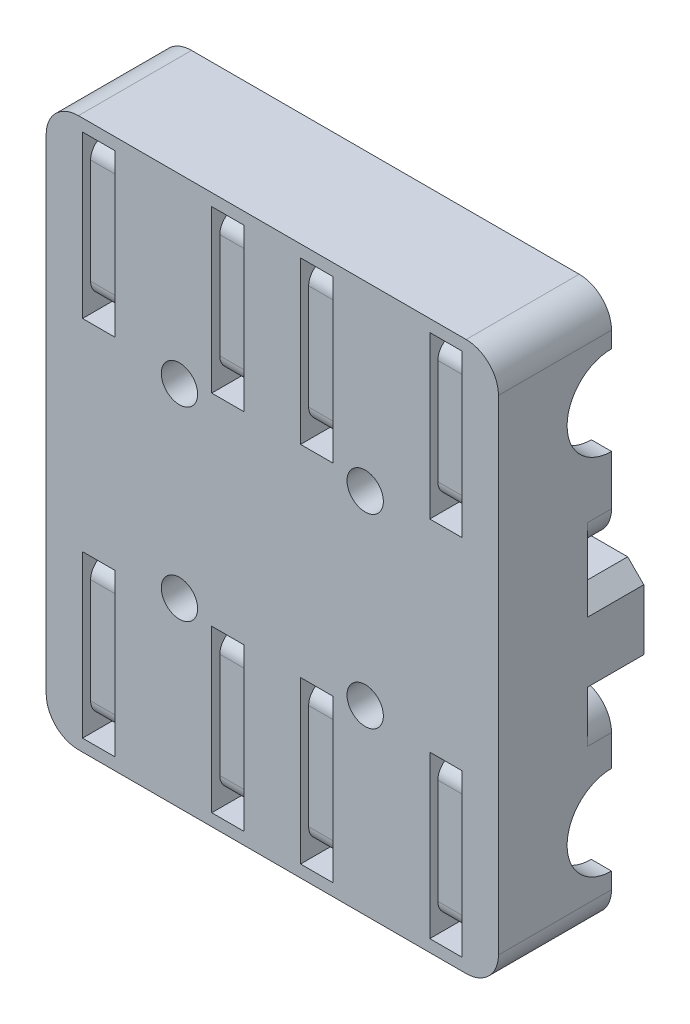
from build123d import *

# Parameters (mm, degrees)
SKETCH1_W               = 56
SKETCH1_H               = 68
BOSS_EXTRUDE1_DEPTH     = 18
SKETCH2_W               = 4
SKETCH2_H               = 1.5
SKETCH2_R               = 2.25
CUT_EXTRUDE1_DEPTH      = 90.911067172
SKETCH3_W               = 4
SKETCH3_H               = 17
CUT_EXTRUDE2_DEPTH      = 1
SKETCH5_R               = 7.5
CUT_EXTRUDE3_DEPTH      = 24.5
SKETCH7_R               = 5.5
CUT_EXTRUDE4_DEPTH      = 90.911067172
MIRROR3_COPY_1_SKETCH_R = 7.5
MIRROR3_COPY_1_DEPTH    = 24.5
FILLET1_R               = 2
CUT_EXTRUDE6_DEPTH      = 7
SKETCH10_W              = 4
SKETCH10_H              = 24.84428877
SKETCH10_H_2            = 27.15571123
CUT_EXTRUDE7_DEPTH      = 90.911067172


with BuildPart() as part:
    # Sketch1 → Boss-Extrude1 (new body)
    with BuildSketch(Plane.XY):
        with Locations((28, 34)):
            Rectangle(SKETCH1_W, SKETCH1_H)
    extrude(amount=BOSS_EXTRUDE1_DEPTH)

    # Sketch2 → Cut-Extrude1 (cut, through all)
    with BuildSketch(Plane.XY.offset(18)):
        with Locations((6.5, 65.75)):
            Rectangle(SKETCH2_W, SKETCH2_H)
        with Locations((22.5, 65.75)):
            Rectangle(SKETCH2_W, SKETCH2_H)
        with Locations((33.5, 65.75)):
            Rectangle(SKETCH2_W, SKETCH2_H)
        with Locations((49.5, 47.25)):
            Rectangle(SKETCH2_W, SKETCH2_H)
        with Locations((39.5, 45.5)):
            Circle(SKETCH2_R)
        with Locations((33.5, 47.25)):
            Rectangle(SKETCH2_W, SKETCH2_H)
        with Locations((22.5, 47.25)):
            Rectangle(SKETCH2_W, SKETCH2_H)
        with Locations((16.5, 45.5)):
            Circle(SKETCH2_R)
        with Locations((6.5, 47.25)):
            Rectangle(SKETCH2_W, SKETCH2_H)
        with Locations((6.5, 20.75)):
            Rectangle(SKETCH2_W, SKETCH2_H)
        with Locations((16.5, 22.5)):
            Circle(SKETCH2_R)
        with Locations((22.5, 20.75)):
            Rectangle(SKETCH2_W, SKETCH2_H)
        with Locations((39.5, 22.5)):
            Circle(SKETCH2_R)
        with Locations((22.5, 2.25)):
            Rectangle(SKETCH2_W, SKETCH2_H)
        with BuildLine():
            ThreePointArc((4, 0), (1.171572875, 1.171572875), (0, 4))
            Line((0, 4), (0, 0))
            Line((0, 0), (4, 0))
        make_face()
        with BuildLine():
            Line((56, 0), (56, 4))
            ThreePointArc((56, 4), (54.828427125, 1.171572875), (52, 0))
            Line((52, 0), (56, 0))
        make_face()
        with BuildLine():
            ThreePointArc((0, 64), (1.171572875, 66.828427125), (4, 68))
            Line((4, 68), (0, 68))
            Line((0, 68), (0, 64))
        make_face()
        with BuildLine():
            Line((56, 68), (52, 68))
            ThreePointArc((52, 68), (54.828427125, 66.828427125), (56, 64))
            Line((56, 64), (56, 68))
        make_face()
        with Locations((49.5, 65.75)):
            Rectangle(SKETCH2_W, SKETCH2_H)
        with Locations((33.5, 20.75)):
            Rectangle(SKETCH2_W, SKETCH2_H)
        with Locations((49.5, 20.75)):
            Rectangle(SKETCH2_W, SKETCH2_H)
        with Locations((49.5, 2.25)):
            Rectangle(SKETCH2_W, SKETCH2_H)
        with Locations((33.5, 2.25)):
            Rectangle(SKETCH2_W, SKETCH2_H)
        with Locations((6.5, 2.25)):
            Rectangle(SKETCH2_W, SKETCH2_H)
    extrude(amount=-CUT_EXTRUDE1_DEPTH, mode=Mode.SUBTRACT)

    # Sketch3 → Cut-Extrude2 (cut)
    with BuildSketch(Plane.XY.offset(18)):
        with Locations((6.5, 56.5)):
            Rectangle(SKETCH3_W, SKETCH3_H)
        with Locations((22.5, 56.5)):
            Rectangle(SKETCH3_W, SKETCH3_H)
        with Locations((33.5, 56.5)):
            Rectangle(SKETCH3_W, SKETCH3_H)
        with Locations((49.5, 56.5)):
            Rectangle(SKETCH3_W, SKETCH3_H)
        with Locations((49.5, 11.5)):
            Rectangle(SKETCH3_W, SKETCH3_H)
        with Locations((33.5, 11.5)):
            Rectangle(SKETCH3_W, SKETCH3_H)
        with Locations((22.5, 11.5)):
            Rectangle(SKETCH3_W, SKETCH3_H)
        with Locations((6.5, 11.5)):
            Rectangle(SKETCH3_W, SKETCH3_H)
    extrude(amount=-CUT_EXTRUDE2_DEPTH, mode=Mode.SUBTRACT)

    # Sketch5 → Cut-Extrude3 (cut)
    with BuildSketch(Plane(origin=(53.5, 0, 0), x_dir=(0, 0, -1), z_dir=(1, 0, 0))):
        with Locations((-4, 11.5)):
            Circle(SKETCH5_R)
    cut_extrude3 = extrude(amount=-CUT_EXTRUDE3_DEPTH, mode=Mode.SUBTRACT)

    # Mirror1: Cut-Extrude3 across plane
    add(cut_extrude3.mirror(Plane(origin=(28, 0, 0), x_dir=(0, 0, 1), z_dir=(1, 0, 0))), mode=Mode.SUBTRACT)

    # Sketch7 → Cut-Extrude4 (cut, through all)
    with BuildSketch(Plane(origin=(56, 0, 0), x_dir=(0, 0, -1), z_dir=(1, 0, 0))):
        with Locations((-4, 11.5)):
            Circle(SKETCH7_R)
    cut_extrude4 = extrude(amount=-CUT_EXTRUDE4_DEPTH, mode=Mode.SUBTRACT)

    # Mirror3: Cut-Extrude3, Cut-Extrude4 across plane
    add(cut_extrude3.mirror(Plane(origin=(0, 34, 0), x_dir=(0, 0, 1), z_dir=(0, -1, 0))), mode=Mode.SUBTRACT)
    add(cut_extrude4.mirror(Plane(origin=(0, 34, 0), x_dir=(0, 0, 1), z_dir=(0, -1, 0))), mode=Mode.SUBTRACT)

    # Mirror3 copy 1 sketch → Mirror3 copy 1 (cut)
    with BuildSketch(Plane(origin=(2.5, 68, 0), x_dir=(0, 0, -1), z_dir=(-1, 0, 0))):
        with Locations((-4, 11.5)):
            Circle(MIRROR3_COPY_1_SKETCH_R)
    extrude(amount=-MIRROR3_COPY_1_DEPTH, mode=Mode.SUBTRACT)

    # Fillet1
    fillet1_edges = [part.edges().sort_by_distance(p)[0] for p in [
        (6.5, 65, 17),
        (6.5, 48, 17),
        (22.5, 65, 17),
        (22.5, 48, 17),
        (33.5, 65, 17),
        (33.5, 48, 17),
        (49.5, 65, 17),
        (49.5, 48, 17),
        (49.5, 3, 17),
        (49.5, 20, 17),
        (33.5, 3, 17),
        (33.5, 20, 17),
        (22.5, 3, 17),
        (22.5, 20, 17),
        (6.5, 3, 17),
        (6.5, 20, 17),
    ]]
    fillet(fillet1_edges, radius=FILLET1_R)

    # Sketch9 → Cut-Extrude6 (cut)
    with BuildSketch(Plane(origin=(0, 0, 0), x_dir=(-1, 0, 0), z_dir=(0, 0, -1))):
        with BuildLine():
            Line((-52, 24.84428877), (-4, 24.84428877))
            ThreePointArc((-4, 24.84428877), (-1.171572875, 23.672715895), (0, 20.84428877))
            Line((0, 20.84428877), (0, 44.84428877))
            ThreePointArc((0, 44.84428877), (-1.171572875, 42.015861645), (-4, 40.84428877))
            Line((-4, 40.84428877), (-52, 40.84428877))
            ThreePointArc((-52, 40.84428877), (-54.828427125, 42.015861645), (-56, 44.84428877))
            Line((-56, 44.84428877), (-56, 20.84428877))
            ThreePointArc((-56, 20.84428877), (-54.828427125, 23.672715895), (-52, 24.84428877))
        make_face()
        with BuildLine():
            Line((-52.431111111, 27.701967566), (-52.242222222, 27.335469288))
            ThreePointArc((-52.242222222, 27.335469288), (-52.150129401, 27.236537266), (-52.02, 27.2))
            Line((-52.02, 27.2), (-51.83, 27.2))
            ThreePointArc((-51.83, 27.2), (-51.699870599, 27.236537266), (-51.607777778, 27.335469288))
            Line((-51.607777778, 27.335469288), (-51.418888889, 27.701967566))
            ThreePointArc((-51.418888889, 27.701967566), (-50.93, 28), (-50.441111111, 27.701967566))
            Line((-50.441111111, 27.701967566), (-50.252222222, 27.335469288))
            ThreePointArc((-50.252222222, 27.335469288), (-50.160129401, 27.236537266), (-50.03, 27.2))
            Line((-50.03, 27.2), (-49.84, 27.2))
            ThreePointArc((-49.84, 27.2), (-49.709870599, 27.236537266), (-49.617777778, 27.335469288))
            Line((-49.617777778, 27.335469288), (-49.428888889, 27.701967566))
            ThreePointArc((-49.428888889, 27.701967566), (-48.94, 27.980641059), (-48.451111111, 27.701967566))
            Line((-48.451111111, 27.701967566), (-48.262222222, 27.335469288))
            ThreePointArc((-48.262222222, 27.335469288), (-48.170129401, 27.236537266), (-48.04, 27.2))
            Line((-48.04, 27.2), (-47.85, 27.2))
            ThreePointArc((-47.85, 27.2), (-47.719870599, 27.236537266), (-47.627777778, 27.335469288))
            Line((-47.627777778, 27.335469288), (-47.438888889, 27.701967566))
            ThreePointArc((-47.438888889, 27.701967566), (-46.95, 28), (-46.461111111, 27.701967566))
            Line((-46.461111111, 27.701967566), (-46.272222222, 27.335469288))
            ThreePointArc((-46.272222222, 27.335469288), (-46.180129401, 27.236537266), (-46.05, 27.2))
            Line((-46.05, 27.2), (-45.86, 27.2))
            ThreePointArc((-45.86, 27.2), (-45.729870599, 27.236537266), (-45.637777778, 27.335469288))
            Line((-45.637777778, 27.335469288), (-45.448888889, 27.701967566))
            ThreePointArc((-45.448888889, 27.701967566), (-44.96, 28), (-44.471111111, 27.701967566))
            Line((-44.471111111, 27.701967566), (-44.282222222, 27.335469288))
            ThreePointArc((-44.282222222, 27.335469288), (-44.190129401, 27.236537266), (-44.06, 27.2))
            Line((-44.06, 27.2), (-43.87, 27.2))
            ThreePointArc((-43.87, 27.2), (-43.739870599, 27.236537266), (-43.647777778, 27.335469288))
            Line((-43.647777778, 27.335469288), (-43.458888889, 27.701967566))
            ThreePointArc((-43.458888889, 27.701967566), (-42.97, 28), (-42.481111111, 27.701967566))
            Line((-42.481111111, 27.701967566), (-42.292222222, 27.335469288))
            ThreePointArc((-42.292222222, 27.335469288), (-42.200129401, 27.236537266), (-42.07, 27.2))
            Line((-42.07, 27.2), (-41.88, 27.2))
            ThreePointArc((-41.88, 27.2), (-41.749870599, 27.236537266), (-41.657777778, 27.335469288))
            Line((-41.657777778, 27.335469288), (-41.468888889, 27.701967566))
            ThreePointArc((-41.468888889, 27.701967566), (-40.98, 28), (-40.491111111, 27.701967566))
            Line((-40.491111111, 27.701967566), (-40.302222222, 27.335469288))
            ThreePointArc((-40.302222222, 27.335469288), (-40.210129401, 27.236537266), (-40.08, 27.2))
            Line((-40.08, 27.2), (-39.89, 27.2))
            ThreePointArc((-39.89, 27.2), (-39.759870599, 27.236537266), (-39.667777778, 27.335469288))
            Line((-39.667777778, 27.335469288), (-39.478888889, 27.701967566))
            ThreePointArc((-39.478888889, 27.701967566), (-38.99, 28), (-38.501111111, 27.701967566))
            Line((-38.501111111, 27.701967566), (-38.312222222, 27.335469288))
            ThreePointArc((-38.312222222, 27.335469288), (-38.220129401, 27.236537266), (-38.09, 27.2))
            Line((-38.09, 27.2), (-37.9, 27.2))
            ThreePointArc((-37.9, 27.2), (-37.769870599, 27.236537266), (-37.677777778, 27.335469288))
            Line((-37.677777778, 27.335469288), (-37.488888889, 27.701967566))
            ThreePointArc((-37.488888889, 27.701967566), (-37, 28), (-36.511111111, 27.701967566))
            Line((-36.511111111, 27.701967566), (-36.322222222, 27.335469288))
            ThreePointArc((-36.322222222, 27.335469288), (-36.230129401, 27.236537266), (-36.1, 27.2))
            Line((-36.1, 27.2), (-35.91, 27.2))
            ThreePointArc((-35.91, 27.2), (-35.779870599, 27.236537266), (-35.687777778, 27.335469288))
            Line((-35.687777778, 27.335469288), (-35.498888889, 27.701967566))
            ThreePointArc((-35.498888889, 27.701967566), (-35.01, 28), (-34.521111111, 27.701967566))
            Line((-34.521111111, 27.701967566), (-34.332222222, 27.335469288))
            ThreePointArc((-34.332222222, 27.335469288), (-34.240129401, 27.236537266), (-34.11, 27.2))
            Line((-34.11, 27.2), (-34.11, 34.7))
            Line((-34.11, 34.7), (-36.11, 36.7))
            Line((-36.11, 36.7), (-54, 36.7))
            Line((-54, 36.7), (-56, 34.7))
            Line((-56, 34.7), (-56, 27.2))
            Line((-56, 27.2), (-55.81, 27.2))
            ThreePointArc((-55.81, 27.2), (-55.679870599, 27.236537266), (-55.587777778, 27.335469288))
            Line((-55.587777778, 27.335469288), (-55.398888889, 27.701967566))
            ThreePointArc((-55.398888889, 27.701967566), (-54.91, 28), (-54.421111111, 27.701967566))
            Line((-54.421111111, 27.701967566), (-54.232222222, 27.335469288))
            ThreePointArc((-54.232222222, 27.335469288), (-54.140129401, 27.236537266), (-54.01, 27.2))
            Line((-54.01, 27.2), (-53.82, 27.2))
            ThreePointArc((-53.82, 27.2), (-53.689870599, 27.236537266), (-53.597777778, 27.335469288))
            Line((-53.597777778, 27.335469288), (-53.408888889, 27.701967566))
            ThreePointArc((-53.408888889, 27.701967566), (-52.92, 28), (-52.431111111, 27.701967566))
        make_face(mode=Mode.SUBTRACT)
        with BuildLine():
            Line((-21.89, 34.7), (-19.89, 36.7))
            Line((-19.89, 36.7), (-2, 36.7))
            Line((-2, 36.7), (0, 34.7))
            Line((0, 34.7), (0, 27.2))
            Line((0, 27.2), (-0.19, 27.2))
            ThreePointArc((-0.19, 27.2), (-0.320129401, 27.236537266), (-0.412222222, 27.335469288))
            Line((-0.412222222, 27.335469288), (-0.601111111, 27.701967566))
            ThreePointArc((-0.601111111, 27.701967566), (-1.09, 28), (-1.578888889, 27.701967566))
            Line((-1.578888889, 27.701967566), (-1.767777778, 27.335469288))
            ThreePointArc((-1.767777778, 27.335469288), (-1.859870599, 27.236537266), (-1.99, 27.2))
            Line((-1.99, 27.2), (-2.18, 27.2))
            ThreePointArc((-2.18, 27.2), (-2.310129401, 27.236537266), (-2.402222222, 27.335469288))
            Line((-2.402222222, 27.335469288), (-2.591111111, 27.701967566))
            ThreePointArc((-2.591111111, 27.701967566), (-3.08, 28), (-3.568888889, 27.701967566))
            Line((-3.568888889, 27.701967566), (-3.757777778, 27.335469288))
            ThreePointArc((-3.757777778, 27.335469288), (-3.849870599, 27.236537266), (-3.98, 27.2))
            Line((-3.98, 27.2), (-4.17, 27.2))
            ThreePointArc((-4.17, 27.2), (-4.300129401, 27.236537266), (-4.392222222, 27.335469288))
            Line((-4.392222222, 27.335469288), (-4.581111111, 27.701967566))
            ThreePointArc((-4.581111111, 27.701967566), (-5.07, 28), (-5.558888889, 27.701967566))
            Line((-5.558888889, 27.701967566), (-5.747777778, 27.335469288))
            ThreePointArc((-5.747777778, 27.335469288), (-5.839870599, 27.236537266), (-5.97, 27.2))
            Line((-5.97, 27.2), (-6.16, 27.2))
            ThreePointArc((-6.16, 27.2), (-6.290129401, 27.236537266), (-6.382222222, 27.335469288))
            Line((-6.382222222, 27.335469288), (-6.571111111, 27.701967566))
            ThreePointArc((-6.571111111, 27.701967566), (-7.06, 27.980641059), (-7.548888889, 27.701967566))
            Line((-7.548888889, 27.701967566), (-7.737777778, 27.335469288))
            ThreePointArc((-7.737777778, 27.335469288), (-7.829870599, 27.236537266), (-7.96, 27.2))
            Line((-7.96, 27.2), (-8.15, 27.2))
            ThreePointArc((-8.15, 27.2), (-8.280129401, 27.236537266), (-8.372222222, 27.335469288))
            Line((-8.372222222, 27.335469288), (-8.561111111, 27.701967566))
            ThreePointArc((-8.561111111, 27.701967566), (-9.05, 28), (-9.538888889, 27.701967566))
            Line((-9.538888889, 27.701967566), (-9.727777778, 27.335469288))
            ThreePointArc((-9.727777778, 27.335469288), (-9.819870599, 27.236537266), (-9.95, 27.2))
            Line((-9.95, 27.2), (-10.14, 27.2))
            ThreePointArc((-10.14, 27.2), (-10.270129401, 27.236537266), (-10.362222222, 27.335469288))
            Line((-10.362222222, 27.335469288), (-10.551111111, 27.701967566))
            ThreePointArc((-10.551111111, 27.701967566), (-11.04, 28), (-11.528888889, 27.701967566))
            Line((-11.528888889, 27.701967566), (-11.717777778, 27.335469288))
            ThreePointArc((-11.717777778, 27.335469288), (-11.809870599, 27.236537266), (-11.94, 27.2))
            Line((-11.94, 27.2), (-12.13, 27.2))
            ThreePointArc((-12.13, 27.2), (-12.260129401, 27.236537266), (-12.352222222, 27.335469288))
            Line((-12.352222222, 27.335469288), (-12.541111111, 27.701967566))
            ThreePointArc((-12.541111111, 27.701967566), (-13.03, 28), (-13.518888889, 27.701967566))
            Line((-13.518888889, 27.701967566), (-13.707777778, 27.335469288))
            ThreePointArc((-13.707777778, 27.335469288), (-13.799870599, 27.236537266), (-13.93, 27.2))
            Line((-13.93, 27.2), (-14.12, 27.2))
            ThreePointArc((-14.12, 27.2), (-14.250129401, 27.236537266), (-14.342222222, 27.335469288))
            Line((-14.342222222, 27.335469288), (-14.531111111, 27.701967566))
            ThreePointArc((-14.531111111, 27.701967566), (-15.02, 28), (-15.508888889, 27.701967566))
            Line((-15.508888889, 27.701967566), (-15.697777778, 27.335469288))
            ThreePointArc((-15.697777778, 27.335469288), (-15.789870599, 27.236537266), (-15.92, 27.2))
            Line((-15.92, 27.2), (-16.11, 27.2))
            ThreePointArc((-16.11, 27.2), (-16.240129401, 27.236537266), (-16.332222222, 27.335469288))
            Line((-16.332222222, 27.335469288), (-16.521111111, 27.701967566))
            ThreePointArc((-16.521111111, 27.701967566), (-17.01, 28), (-17.498888889, 27.701967566))
            Line((-17.498888889, 27.701967566), (-17.687777778, 27.335469288))
            ThreePointArc((-17.687777778, 27.335469288), (-17.779870599, 27.236537266), (-17.91, 27.2))
            Line((-17.91, 27.2), (-18.1, 27.2))
            ThreePointArc((-18.1, 27.2), (-18.230129401, 27.236537266), (-18.322222222, 27.335469288))
            Line((-18.322222222, 27.335469288), (-18.511111111, 27.701967566))
            ThreePointArc((-18.511111111, 27.701967566), (-19, 28), (-19.488888889, 27.701967566))
            Line((-19.488888889, 27.701967566), (-19.677777778, 27.335469288))
            ThreePointArc((-19.677777778, 27.335469288), (-19.769870599, 27.236537266), (-19.9, 27.2))
            Line((-19.9, 27.2), (-20.09, 27.2))
            ThreePointArc((-20.09, 27.2), (-20.220129401, 27.236537266), (-20.312222222, 27.335469288))
            Line((-20.312222222, 27.335469288), (-20.501111111, 27.701967566))
            ThreePointArc((-20.501111111, 27.701967566), (-20.99, 28), (-21.478888889, 27.701967566))
            Line((-21.478888889, 27.701967566), (-21.667777778, 27.335469288))
            ThreePointArc((-21.667777778, 27.335469288), (-21.759870599, 27.236537266), (-21.89, 27.2))
            Line((-21.89, 27.2), (-21.89, 34.7))
        make_face(mode=Mode.SUBTRACT)
    extrude(amount=-CUT_EXTRUDE6_DEPTH, mode=Mode.SUBTRACT)

    # Sketch10 → Cut-Extrude7 (cut, through all)
    with BuildSketch(Plane.ZY):
        with Locations((2, 12.422144385)):
            Rectangle(SKETCH10_W, SKETCH10_H)
        with Locations((2, 54.422144385)):
            Rectangle(SKETCH10_W, SKETCH10_H_2)
    extrude(amount=-CUT_EXTRUDE7_DEPTH, mode=Mode.SUBTRACT)


solid = part.part
